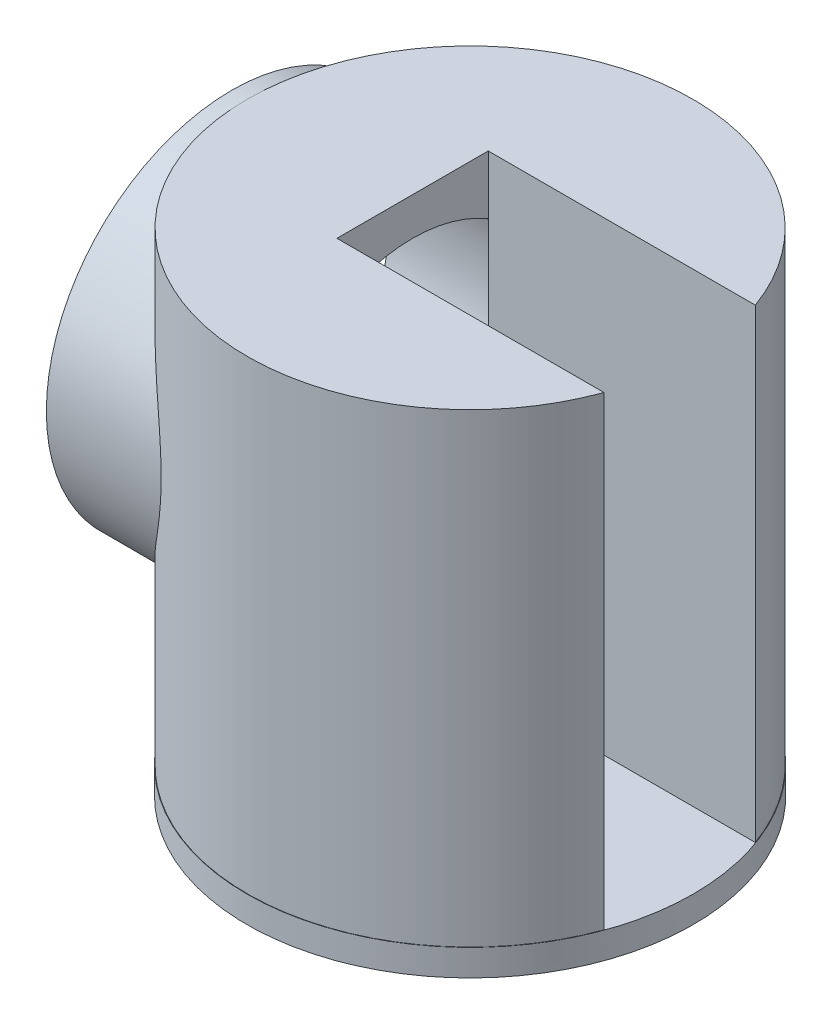
from build123d import *

# Parameters (mm, degrees)
SKETCH_1_R               = 29.5
EXTRUDE_1_DEPTH          = 4
SKETCH_2_R               = 1.5
CUT_EXTRUDE_1_DEPTH      = 42.910619179
PATTERN_CIRCULAR_1_COUNT = 4
SKETCH_3_R               = 29.444869788
EXTRUDE_2_DEPTH          = 61.5
SKETCH_4_W               = 39.5
SKETCH_4_H               = 20
CUT_EXTRUDE_2_DEPTH      = 61.5
EXTRUDE_START            = -10
SKETCH_7_R               = 24.5
SKETCH_7_R_2             = 21
EXTRUDE_3_DEPTH          = 21.5
CUT_EXTRUDE_START        = -17
SKETCH_11_R              = 21
CUT_EXTRUDE_7_DEPTH      = 17
SKETCH_12_R              = 19.5
CUT_EXTRUDE_10_DEPTH     = 23.9
SKETCH_13_R              = 29.5
SKETCH_13_R_2            = 19.5
CUT_EXTRUDE_11_DEPTH     = 0.5


with BuildPart() as part:
    # Эскиз1 → Бобышка-Вытянуть1 (new body)
    with BuildSketch(Plane(origin=(0, 0, 0), x_dir=(1, 0, 0), z_dir=(0, 1, 0))):
        with Locations(Location((0, 0, 0), (0, 0, 270))):
            Circle(SKETCH_1_R)
    extrude(amount=EXTRUDE_1_DEPTH)

    # Эскиз2 → Вырез-Вытянуть1 (cut, through all)
    with BuildSketch(Plane(origin=(0, 4, 0), x_dir=(1, 0, 0), z_dir=(0, 1, 0))):
        with Locations(Location((7, 0, 0), (0, 0, 270))):
            Circle(SKETCH_2_R)
    cut_extrude_1 = extrude(amount=-CUT_EXTRUDE_1_DEPTH, mode=Mode.SUBTRACT)

    # Круговой массив1: Вырез-Вытянуть1 ×4 about axis
    pattern_circular_1_axis = Axis((0, 0, 0), (0, 1, 0))
    for i in range(1, PATTERN_CIRCULAR_1_COUNT):
        add(cut_extrude_1.rotate(pattern_circular_1_axis, i * 360 / PATTERN_CIRCULAR_1_COUNT), mode=Mode.SUBTRACT)

    # Эскиз3 → Бобышка-Вытянуть2 (add)
    with BuildSketch(Plane(origin=(0, 4, 0), x_dir=(1, 0, 0), z_dir=(0, 1, 0))):
        with Locations(Location((0, 0, 0), (0, 0, 270))):
            Circle(SKETCH_3_R)
    extrude(amount=EXTRUDE_2_DEPTH)

    # Эскиз4 → Вырез-Вытянуть2 (cut)
    with BuildSketch(Plane(origin=(0, 65.5, 0), x_dir=(1, 0, 0), z_dir=(0, 1, 0))):
        with Locations((12.15, 0)):
            Rectangle(SKETCH_4_W, SKETCH_4_H)
    extrude(amount=-CUT_EXTRUDE_2_DEPTH, mode=Mode.SUBTRACT)

    # Эскиз7 → Бобышка-Вытянуть3 (add)
    with BuildSketch(Plane(origin=(0, 0, 0), x_dir=(0, 0, -1), z_dir=(1, 0, 0)).offset(EXTRUDE_START)):
        with Locations((0, 41)):
            Circle(SKETCH_7_R)
        with Locations((0, 41)):
            Circle(SKETCH_7_R_2, mode=Mode.SUBTRACT)
    extrude(amount=-EXTRUDE_3_DEPTH)

    # Эскиз11 → Вырез-Вытянуть7 (cut)
    with BuildSketch(Plane.ZY.offset(31.5).offset(CUT_EXTRUDE_START)):
        with Locations(Location((0, 41, 0), (0, 0, 180))):
            Circle(SKETCH_11_R)
    extrude(amount=CUT_EXTRUDE_7_DEPTH, mode=Mode.SUBTRACT)

    # Эскиз12 → Вырез-Вытянуть10 (cut)
    with BuildSketch(Plane.ZY.offset(31.5)):
        with Locations((0, 41)):
            Circle(SKETCH_12_R)
    extrude(amount=-CUT_EXTRUDE_10_DEPTH, mode=Mode.SUBTRACT)

    # Эскиз13 → Вырез-Вытянуть11 (cut)
    with BuildSketch(Plane.XZ):
        with Locations(Location((0, 0, 0), (0, 0, 270))):
            Circle(SKETCH_13_R)
        with Locations(Location((0, 0, 0), (0, 0, 270))):
            Circle(SKETCH_13_R_2, mode=Mode.SUBTRACT)
    extrude(amount=-CUT_EXTRUDE_11_DEPTH, mode=Mode.SUBTRACT)


solid = part.part
